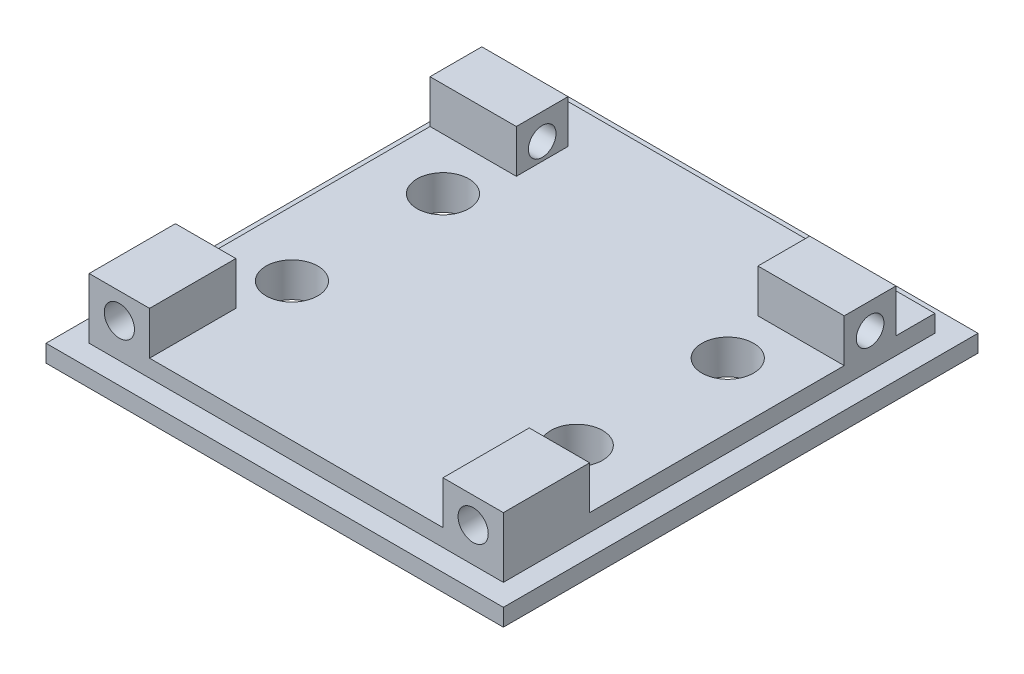
from build123d import *

# Parameters (mm, degrees)
SKETCH1_W               = 53
SKETCH1_H               = 55
TOP_DEPTH               = 2
SKETCH2_W               = 48
SKETCH2_H               = 50
INSIDE_LIP_DEPTH        = 2
SKETCH3_W               = 7
SKETCH3_H               = 10
SKETCH3_W_2             = 10
SKETCH3_H_2             = 6
SCREW_POSTS_DEPTH       = 5
SKETCH4_R               = 1.75
FRONT_SCREW_HOLES_DEPTH = 10
BACK_START              = -48
SKETCH5_R               = 1.6
BACK_SCREW_HOLES_DEPTH  = 48
SKETCH6_R               = 3
CUT_EXTRUDE3_DEPTH      = 4


with BuildPart() as part:
    # Sketch1 → Top (new body)
    with BuildSketch(Plane(origin=(0, 0, 0), x_dir=(1, 0, 0), z_dir=(0, 1, 0))):
        Rectangle(SKETCH1_W, SKETCH1_H)
    extrude(amount=TOP_DEPTH)

    # Sketch2 → Inside Lip (add)
    with BuildSketch(Plane(origin=(0, 2, 0), x_dir=(1, 0, 0), z_dir=(0, 1, 0))):
        Rectangle(SKETCH2_W, SKETCH2_H)
    extrude(amount=INSIDE_LIP_DEPTH)

    # Sketch3 → Screw Posts (add)
    with BuildSketch(Plane(origin=(0, 4, 0), x_dir=(1, 0, 0), z_dir=(0, 1, 0))):
        with Locations((-20.5, -20)):
            Rectangle(SKETCH3_W, SKETCH3_H)
        with Locations((20.5, -20)):
            Rectangle(SKETCH3_W, SKETCH3_H)
        with Locations((19, 17.5)):
            Rectangle(SKETCH3_W_2, SKETCH3_H_2)
        with Locations((-19, 17.5)):
            Rectangle(SKETCH3_W_2, SKETCH3_H_2)
    extrude(amount=SCREW_POSTS_DEPTH)

    # Sketch4 → Front Screw Holes (cut)
    with BuildSketch(Plane.XY.offset(25)):
        with Locations((-20.5, 6)):
            Circle(SKETCH4_R)
        with Locations((20.5, 6)):
            Circle(SKETCH4_R)
    extrude(amount=-FRONT_SCREW_HOLES_DEPTH, mode=Mode.SUBTRACT)

    # Sketch5 → Back Screw Holes (cut)
    with BuildSketch(Plane(origin=(24, 0, 0), x_dir=(0, 0, -1), z_dir=(1, 0, 0)).offset(BACK_START)):
        with Locations((17.5, 6)):
            Circle(SKETCH5_R)
    extrude(amount=BACK_SCREW_HOLES_DEPTH, mode=Mode.SUBTRACT)

    # Sketch6 → Cut-Extrude3 (cut)
    with BuildSketch(Plane(origin=(0, 4, 0), x_dir=(1, 0, 0), z_dir=(0, 1, 0))):
        with Locations(Location((-16.5, -9, 0), (0, 0, 270))):
            Circle(SKETCH6_R)
        with Locations(Location((-16.5, 8.5, 0), (0, 0, 270))):
            Circle(SKETCH6_R)
        with Locations(Location((16.5, -9, 0), (0, 0, 270))):
            Circle(SKETCH6_R)
        with Locations(Location((16.5, 8.5, 0), (0, 0, 270))):
            Circle(SKETCH6_R)
    extrude(amount=-CUT_EXTRUDE3_DEPTH, mode=Mode.SUBTRACT)


solid = part.part
